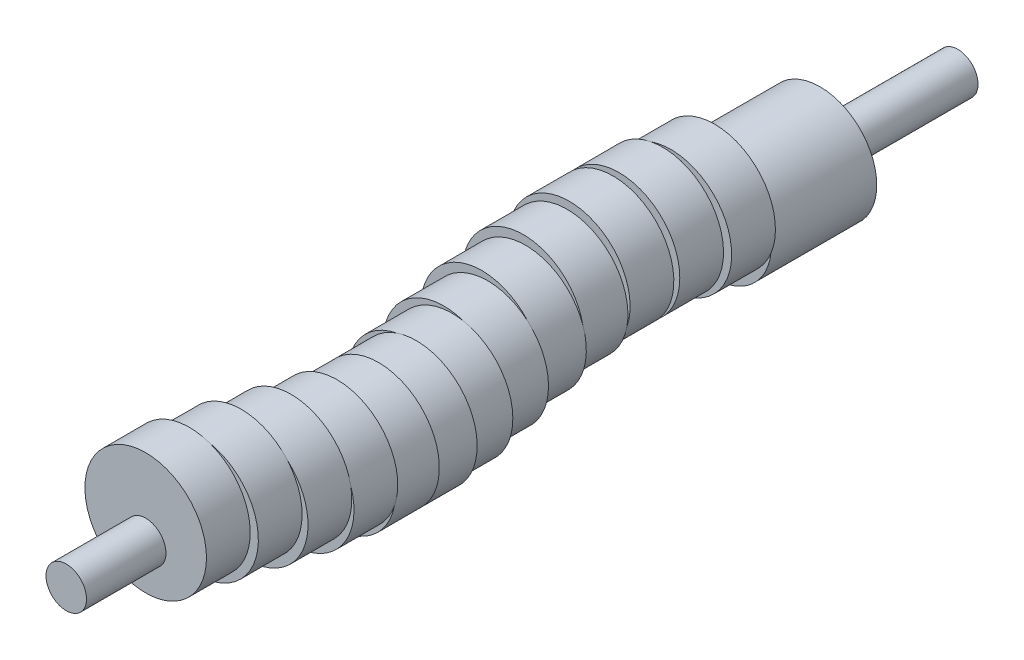
from build123d import *
from build123d.topology import SkipClean

# Parameters (mm, degrees)
SKETCH1_R            = 7.5
SKETCH1_R_2          = 2.5
BOSS_EXTRUDE1_DEPTH  = 5.4
BOSS_EXTRUDE2_START  = 5.4
SKETCH2_R            = 7.5
SKETCH2_R_2          = 2.5
BOSS_EXTRUDE2_DEPTH  = 5.4
BOSS_EXTRUDE3_START  = 5.4
SKETCH3_R            = 7.5
SKETCH3_R_2          = 2.5
BOSS_EXTRUDE3_DEPTH  = 5.4
BOSS_EXTRUDE4_START  = 5.4
SKETCH4_R            = 7.5
SKETCH4_R_2          = 2.5
BOSS_EXTRUDE4_DEPTH  = 5.4
BOSS_EXTRUDE5_START  = 5.4
SKETCH5_R            = 7.5
SKETCH5_R_2          = 2.5
BOSS_EXTRUDE5_DEPTH  = 5.4
BOSS_EXTRUDE6_START  = 5.4
SKETCH6_R            = 7.5
SKETCH6_R_2          = 2.5
BOSS_EXTRUDE6_DEPTH  = 5.4
BOSS_EXTRUDE7_START  = 5.4
SKETCH7_R            = 7.5
SKETCH7_R_2          = 2.5
BOSS_EXTRUDE7_DEPTH  = 5.4
BOSS_EXTRUDE9_START  = 5.4
SKETCH8_R            = 7.5
SKETCH8_R_2          = 2.5
BOSS_EXTRUDE9_DEPTH  = 5.4
BOSS_EXTRUDE10_START = 5.4
SKETCH9_R            = 7.5
SKETCH9_R_2          = 2.5
BOSS_EXTRUDE10_DEPTH = 5.4
BOSS_EXTRUDE11_START = 5.4
SKETCH10_R           = 7.5
SKETCH10_R_2         = 2.5
BOSS_EXTRUDE11_DEPTH = 5.4
BOSS_EXTRUDE12_START = 5.4
SKETCH11_R           = 7.5
SKETCH11_R_2         = 2.5
BOSS_EXTRUDE12_DEPTH = 5.4
BOSS_EXTRUDE13_START = 5.4
SKETCH12_R           = 7.5
SKETCH12_R_2         = 2.5
BOSS_EXTRUDE13_DEPTH = 5.4
BOSS_EXTRUDE14_START = 5.4
SKETCH13_R           = 7.5
SKETCH13_R_2         = 2.5
BOSS_EXTRUDE14_DEPTH = 5.4
SKETCH14_R           = 2.5
BOSS_EXTRUDE15_DEPTH = 80
BOSS_EXTRUDE16_START = 30
SKETCH14_2_R         = 2.5
BOSS_EXTRUDE16_DEPTH = 30
SKETCH15_R           = 7
BOSS_EXTRUDE17_DEPTH = 13


with BuildPart() as part:
    # Sketch1 → Boss-Extrude1 (new body)
    with BuildSketch(Plane.XY):
        with Locations((0, 2)):
            Circle(SKETCH1_R)
        Circle(SKETCH1_R_2, mode=Mode.SUBTRACT)
    extrude(amount=BOSS_EXTRUDE1_DEPTH)

    # Sketch2 → Boss-Extrude2 (add)
    with SkipClean():  # the faces are left unmerged after this step: merging them gives an invalid solid
        with BuildSketch(Plane(origin=(0, 0, 0), x_dir=(-1, 0, 0), z_dir=(0, 0, -1)).offset(BOSS_EXTRUDE2_START)):
            with Locations((-1, 1.732050808)):
                Circle(SKETCH2_R)
            Circle(SKETCH2_R_2, mode=Mode.SUBTRACT)
        extrude(amount=-BOSS_EXTRUDE2_DEPTH)

    # Sketch3 → Boss-Extrude3 (add)
    with SkipClean():  # the faces are left unmerged after this step: merging them gives an invalid solid
        with BuildSketch(Plane(origin=(0, 0, -5.4), x_dir=(-1, 0, 0), z_dir=(0, 0, -1)).offset(BOSS_EXTRUDE3_START)):
            with Locations((-1.732050808, 1)):
                Circle(SKETCH3_R)
            Circle(SKETCH3_R_2, mode=Mode.SUBTRACT)
        extrude(amount=-BOSS_EXTRUDE3_DEPTH)

    # Sketch4 → Boss-Extrude4 (add)
    with SkipClean():  # the faces are left unmerged after this step: merging them gives an invalid solid
        with BuildSketch(Plane(origin=(0, 0, -10.8), x_dir=(-1, 0, 0), z_dir=(0, 0, -1)).offset(BOSS_EXTRUDE4_START)):
            with Locations((-2, 0)):
                Circle(SKETCH4_R)
            Circle(SKETCH4_R_2, mode=Mode.SUBTRACT)
        extrude(amount=-BOSS_EXTRUDE4_DEPTH)

    # Sketch5 → Boss-Extrude5 (add)
    with SkipClean():  # the faces are left unmerged after this step: merging them gives an invalid solid
        with BuildSketch(Plane(origin=(0, 0, -16.2), x_dir=(-1, 0, 0), z_dir=(0, 0, -1)).offset(BOSS_EXTRUDE5_START)):
            with Locations((-1.732050808, -1)):
                Circle(SKETCH5_R)
            Circle(SKETCH5_R_2, mode=Mode.SUBTRACT)
        extrude(amount=-BOSS_EXTRUDE5_DEPTH)

    # Sketch6 → Boss-Extrude6 (add)
    with SkipClean():  # the faces are left unmerged after this step: merging them gives an invalid solid
        with BuildSketch(Plane(origin=(0, 0, -21.6), x_dir=(-1, 0, 0), z_dir=(0, 0, -1)).offset(BOSS_EXTRUDE6_START)):
            with Locations((-1, -1.732050808)):
                Circle(SKETCH6_R)
            Circle(SKETCH6_R_2, mode=Mode.SUBTRACT)
        extrude(amount=-BOSS_EXTRUDE6_DEPTH)

    # Sketch7 → Boss-Extrude7 (add)
    with SkipClean():  # the faces are left unmerged after this step: merging them gives an invalid solid
        with BuildSketch(Plane(origin=(0, 0, -27), x_dir=(-1, 0, 0), z_dir=(0, 0, -1)).offset(BOSS_EXTRUDE7_START)):
            with Locations((0, -2)):
                Circle(SKETCH7_R)
            Circle(SKETCH7_R_2, mode=Mode.SUBTRACT)
        extrude(amount=-BOSS_EXTRUDE7_DEPTH)

    # Sketch8 → Boss-Extrude9 (add)
    with SkipClean():  # the faces are left unmerged after this step: merging them gives an invalid solid
        with BuildSketch(Plane(origin=(0, 0, -32.4), x_dir=(-1, 0, 0), z_dir=(0, 0, -1)).offset(BOSS_EXTRUDE9_START)):
            with Locations((1, -1.732050808)):
                Circle(SKETCH8_R)
            Circle(SKETCH8_R_2, mode=Mode.SUBTRACT)
        extrude(amount=-BOSS_EXTRUDE9_DEPTH)

    # Sketch9 → Boss-Extrude10 (add)
    with SkipClean():  # the faces are left unmerged after this step: merging them gives an invalid solid
        with BuildSketch(Plane(origin=(0, 0, -37.8), x_dir=(-1, 0, 0), z_dir=(0, 0, -1)).offset(BOSS_EXTRUDE10_START)):
            with Locations((1.732050808, -1)):
                Circle(SKETCH9_R)
            Circle(SKETCH9_R_2, mode=Mode.SUBTRACT)
        extrude(amount=-BOSS_EXTRUDE10_DEPTH)

    # Sketch10 → Boss-Extrude11 (add)
    with SkipClean():  # the faces are left unmerged after this step: merging them gives an invalid solid
        with BuildSketch(Plane(origin=(0, 0, -43.2), x_dir=(-1, 0, 0), z_dir=(0, 0, -1)).offset(BOSS_EXTRUDE11_START)):
            with Locations((2, 0)):
                Circle(SKETCH10_R)
            Circle(SKETCH10_R_2, mode=Mode.SUBTRACT)
        extrude(amount=-BOSS_EXTRUDE11_DEPTH)

    # Sketch11 → Boss-Extrude12 (add)
    with SkipClean():  # the faces are left unmerged after this step: merging them gives an invalid solid
        with BuildSketch(Plane(origin=(0, 0, -48.6), x_dir=(-1, 0, 0), z_dir=(0, 0, -1)).offset(BOSS_EXTRUDE12_START)):
            with Locations((1.732050808, 1)):
                Circle(SKETCH11_R)
            Circle(SKETCH11_R_2, mode=Mode.SUBTRACT)
        extrude(amount=-BOSS_EXTRUDE12_DEPTH)

    # Sketch12 → Boss-Extrude13 (add)
    with SkipClean():  # the faces are left unmerged after this step: merging them gives an invalid solid
        with BuildSketch(Plane(origin=(0, 0, -54), x_dir=(-1, 0, 0), z_dir=(0, 0, -1)).offset(BOSS_EXTRUDE13_START)):
            with Locations((1, 1.732050808)):
                Circle(SKETCH12_R)
            Circle(SKETCH12_R_2, mode=Mode.SUBTRACT)
        extrude(amount=-BOSS_EXTRUDE13_DEPTH)

    # Sketch13 → Boss-Extrude14 (add)
    with SkipClean():  # the faces are left unmerged after this step: merging them gives an invalid solid
        with BuildSketch(Plane(origin=(0, 0, -59.4), x_dir=(-1, 0, 0), z_dir=(0, 0, -1)).offset(BOSS_EXTRUDE14_START)):
            with Locations((0, 2)):
                Circle(SKETCH13_R)
            Circle(SKETCH13_R_2, mode=Mode.SUBTRACT)
        extrude(amount=-BOSS_EXTRUDE14_DEPTH)

    # Sketch14 → Boss-Extrude15 (add)
    with BuildSketch(Plane(origin=(0, 0, -64.8), x_dir=(-1, 0, 0), z_dir=(0, 0, -1))):
        Circle(SKETCH14_R)
    extrude(amount=-BOSS_EXTRUDE15_DEPTH)

    # Sketch14<2> → Boss-Extrude16 (add)
    with BuildSketch(Plane(origin=(0, 0, -64.8), x_dir=(-1, 0, 0), z_dir=(0, 0, -1)).offset(BOSS_EXTRUDE16_START)):
        Circle(SKETCH14_2_R)
    extrude(amount=-BOSS_EXTRUDE16_DEPTH)

    # Sketch15 → Boss-Extrude17 (add)
    with BuildSketch(Plane(origin=(0, 0, -64.8), x_dir=(-1, 0, 0), z_dir=(0, 0, -1))):
        Circle(SKETCH15_R)
    extrude(amount=BOSS_EXTRUDE17_DEPTH)


solid = part.part
